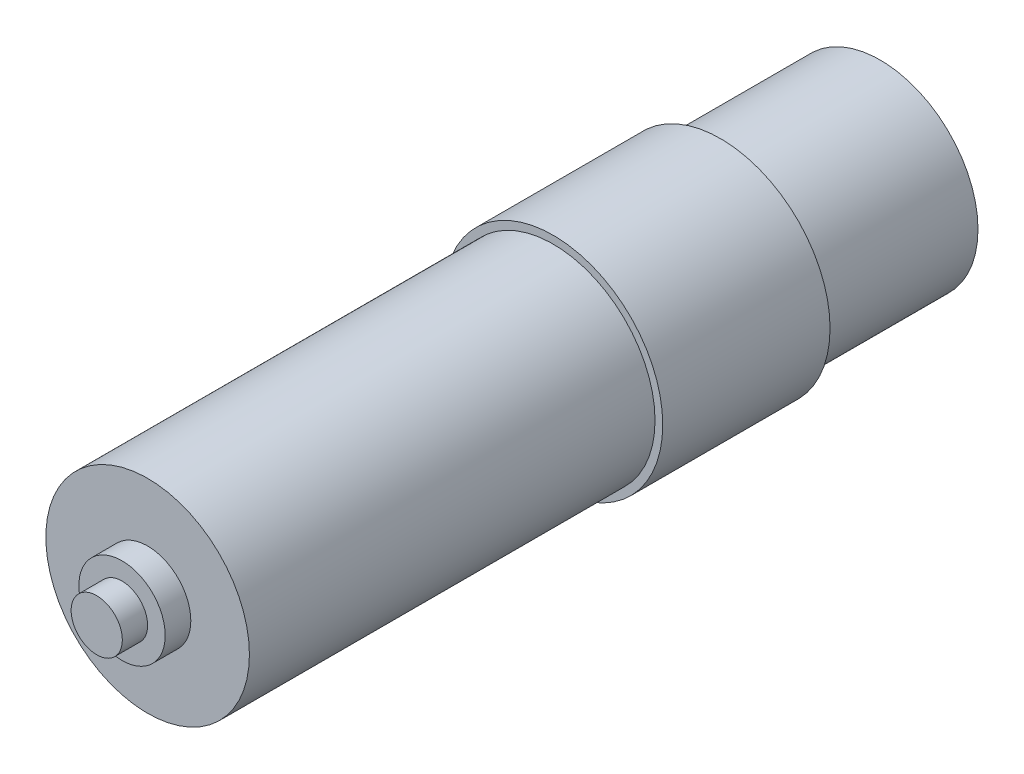
from build123d import *


with BuildPart() as part:
    # Sketch1 → Revolve1 (revolve)
    with BuildSketch(Plane(origin=(0, 0, 0), x_dir=(0, 0, -1), z_dir=(1, 0, 0)), mode=Mode.PRIVATE) as revolve1_sk:
        Polygon((0, 0), (-127, 0), (-127, 4.15), (-122.9, 4.15), (-122.9, 7), (-118.75, 7), (-118.75, 16.5), (-53, 16.5), (-53, 17.75), (-25.88, 17.75), (-25.88, 15.85), (0, 15.85), align=None)
    revolve(revolve1_sk.sketch.rotate(Axis((0, 0, 0), (0, 0, -1)), 90), axis=Axis((0, 0, 0), (0, 0, -1)))


solid = part.part
